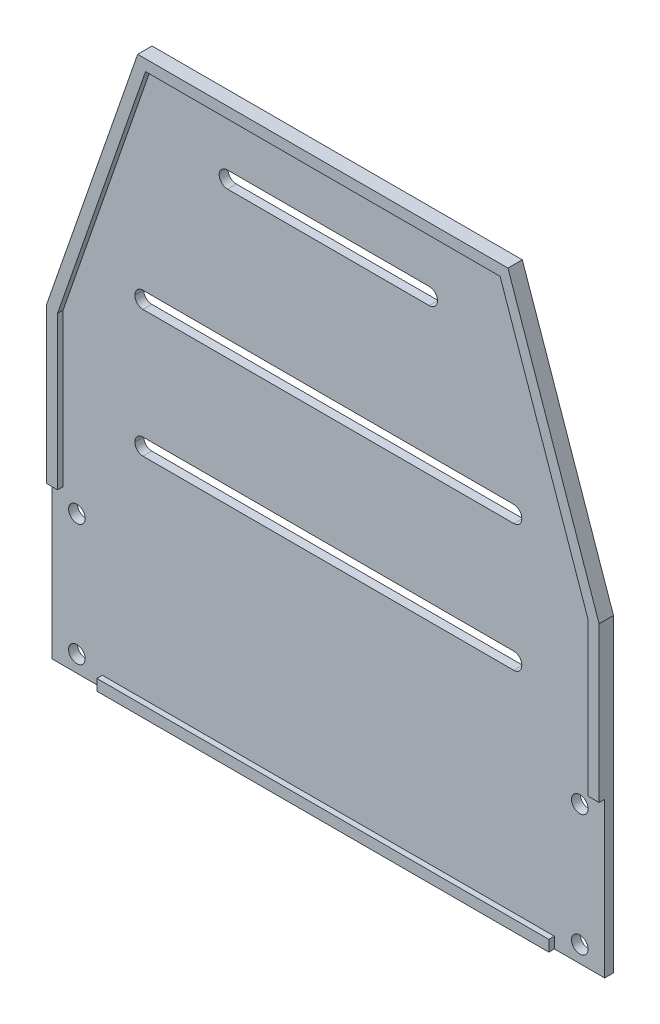
from build123d import *

# Parameters (mm, degrees)
BOSS_EXTRUDE1_DEPTH = 1.6
SKETCH4_R           = 1.5
CUT_EXTRUDE1_DEPTH  = 1.6
SKETCH5_R           = 1.5
CUT_EXTRUDE2_DEPTH  = 1.6
SKETCH6_W           = 36.5
SKETCH6_H           = 3
CUT_EXTRUDE3_DEPTH  = 1.6
CUT_EXTRUDE4_DEPTH  = 1.6
CUT_EXTRUDE5_DEPTH  = 1.6
BOSS_EXTRUDE3_START = 1.6
SKETCH9_W           = 81.8
SKETCH9_H           = 2
BOSS_EXTRUDE3_DEPTH = 1


with BuildPart() as part:
    # Sketch2 → Boss-Extrude1 (new body)
    with BuildSketch(Plane.XY):
        Polygon((50, -51.75), (50, 4.25), (33.5, 51.75), (-33.5, 51.75), (-50, 4.25), (-50, -51.75), align=None)
    extrude(amount=BOSS_EXTRUDE1_DEPTH)

    # Sketch4 → Cut-Extrude1 (cut)
    with BuildSketch(Plane.XY.offset(1.6)):
        with Locations((-45.5, -48.75)):
            Circle(SKETCH4_R)
        with Locations((-45.5, -26.75)):
            Circle(SKETCH4_R)
        with Locations(Location((45.5, -26.75, 0), (0, 0, 180))):
            Circle(SKETCH4_R)
        with Locations(Location((45.5, -48.75, 0), (0, 0, 180))):
            Circle(SKETCH4_R)
    extrude(amount=-CUT_EXTRUDE1_DEPTH, mode=Mode.SUBTRACT)

    # Sketch5 → Cut-Extrude2 (cut)
    with BuildSketch(Plane.XY.offset(1.6)):
        with Locations((-18.25, 39.25)):
            Circle(SKETCH5_R)
        with Locations(Location((18.25, 39.25, 0), (0, 0, 180))):
            Circle(SKETCH5_R)
    extrude(amount=-CUT_EXTRUDE2_DEPTH, mode=Mode.SUBTRACT)

    # Sketch6 → Cut-Extrude3 (cut)
    with BuildSketch(Plane.XY.offset(1.6)):
        with Locations((0, 39.25)):
            Rectangle(SKETCH6_W, SKETCH6_H)
    extrude(amount=-CUT_EXTRUDE3_DEPTH, mode=Mode.SUBTRACT)

    # Sketch7 → Cut-Extrude4 (cut)
    with BuildSketch(Plane.XY):
        with BuildLine():
            Line((-33.55, -11.75), (33.55, -11.75))
            ThreePointArc((33.55, -11.75), (34.575304833, -11.325304833), (35, -10.3))
            Line((35, -10.3), (35, -10.2))
            ThreePointArc((35, -10.2), (34.575304833, -9.174695167), (33.55, -8.75))
            Line((33.55, -8.75), (-33.55, -8.75))
            ThreePointArc((-33.55, -8.75), (-34.575304833, -9.174695167), (-35, -10.2))
            Line((-35, -10.2), (-35, -10.3))
            ThreePointArc((-35, -10.3), (-34.575304833, -11.325304833), (-33.55, -11.75))
        make_face()
    extrude(amount=CUT_EXTRUDE4_DEPTH, mode=Mode.SUBTRACT)

    # Sketch8 → Cut-Extrude5 (cut)
    with BuildSketch(Plane.XY):
        with BuildLine():
            Line((-33.55, 11.25), (33.55, 11.25))
            ThreePointArc((33.55, 11.25), (34.575304833, 11.674695167), (35, 12.7))
            Line((35, 12.7), (35, 12.8))
            ThreePointArc((35, 12.8), (34.575304833, 13.825304833), (33.55, 14.25))
            Line((33.55, 14.25), (-33.55, 14.25))
            ThreePointArc((-33.55, 14.25), (-34.575304833, 13.825304833), (-35, 12.8))
            Line((-35, 12.8), (-35, 12.7))
            ThreePointArc((-35, 12.7), (-34.575304833, 11.674695167), (-33.55, 11.25))
        make_face()
    extrude(amount=CUT_EXTRUDE5_DEPTH, mode=Mode.SUBTRACT)

    # Sketch9 → Boss-Extrude3 (add)
    with BuildSketch(Plane.XY.offset(BOSS_EXTRUDE3_START)):
        Polygon((50, -23.75), (50, 4.25), (33.5, 51.75), (-33.5, 51.75), (-50, 4.25), (-50, -23.75), (-48, -23.75), (-48, 3.91252214), (-32.077507691, 49.75), (32.077507691, 49.75), (48, 3.91252214), (48, -23.75), align=None)
        with Locations((0, -50.75)):
            Rectangle(SKETCH9_W, SKETCH9_H)
    extrude(amount=BOSS_EXTRUDE3_DEPTH)


solid = part.part
